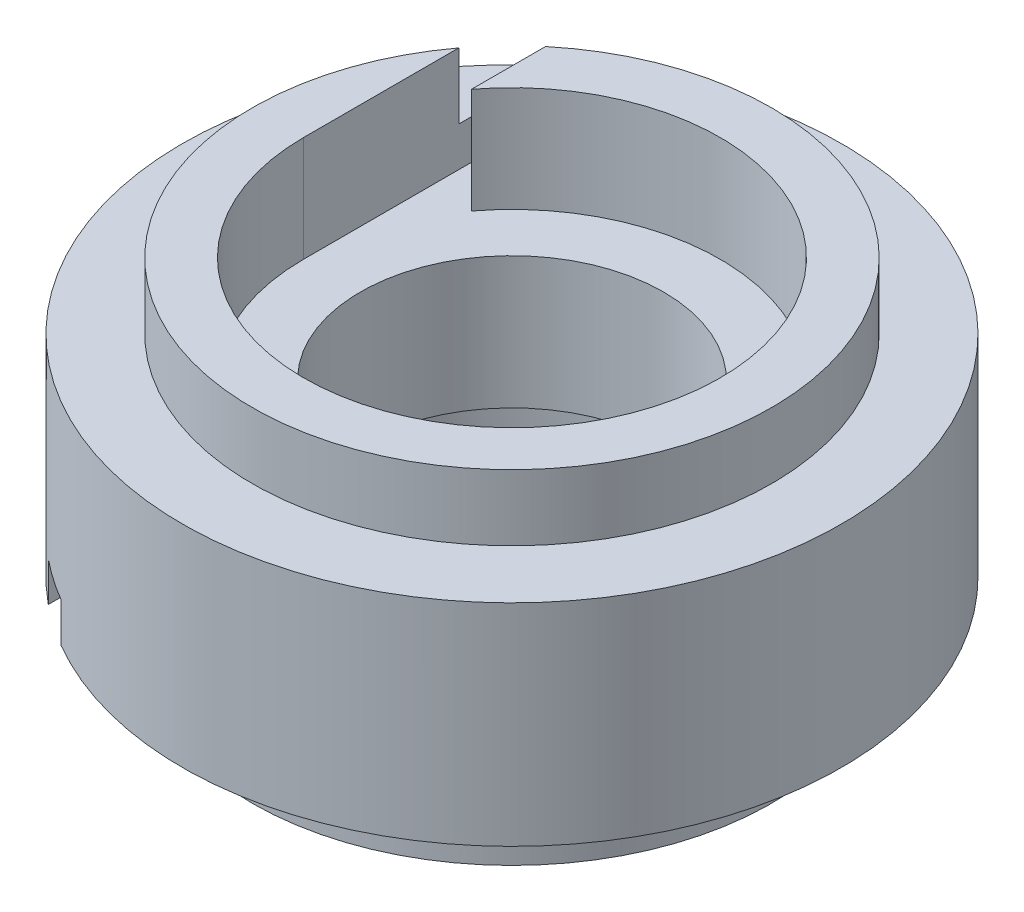
from build123d import *

# Parameters (mm, degrees)
SKETCH1_R           = 31.75
SKETCH1_R_2         = 14.605
BOSS_EXTRUDE1_DEPTH = 16.51
CUT_EXTRUDE1_DEPTH  = 10.16
SKETCH13_R          = 31.75
SKETCH13_R_2        = 25.019
CUT_EXTRUDE2_DEPTH  = 6.35
CIRPATTERN1_COUNT   = 2


with BuildPart() as part:
    # Sketch1 → Boss-Extrude1 (new, symmetric)
    with BuildSketch(Plane(origin=(0, 0, 0), x_dir=(1, 0, 0), z_dir=(0, 1, 0))):
        Circle(SKETCH1_R)
        Circle(SKETCH1_R_2, mode=Mode.SUBTRACT)
    extrude(amount=BOSS_EXTRUDE1_DEPTH, both=True)

    # Sketch2 → Cut-Extrude1 (cut)
    with BuildSketch(Plane(origin=(0, 16.51, 0), x_dir=(1, 0, 0), z_dir=(0, 1, 0))):
        with BuildLine():
            Line((-20.066, 0), (-20.066, 24.60524627))
            ThreePointArc((-20.066, 24.60524627), (-18.088933462, 26.093159759), (-16.002, 27.422590979))
            Line((-16.002, 27.422590979), (-16.002, 12.107037292))
            ThreePointArc((-16.002, 12.107037292), (19.022887373, -6.385460986), (-20.066, 0))
        make_face()
    cut_extrude1 = extrude(amount=-CUT_EXTRUDE1_DEPTH, mode=Mode.SUBTRACT)

    # Sketch13 → Cut-Extrude2 (cut)
    with BuildSketch(Plane(origin=(0, 16.51, 0), x_dir=(1, 0, 0), z_dir=(0, 1, 0))):
        Circle(SKETCH13_R)
        Circle(SKETCH13_R_2, mode=Mode.SUBTRACT)
    cut_extrude2 = extrude(amount=-CUT_EXTRUDE2_DEPTH, mode=Mode.SUBTRACT)

    # CirPattern1: Cut-Extrude1, Cut-Extrude2 ×2 about axis
    cirpattern1_axis = Axis((34.925, 0, 0), (-1, 0, 0))
    add([cut_extrude1.rotate(cirpattern1_axis, i * 360 / CIRPATTERN1_COUNT) for i in range(1, CIRPATTERN1_COUNT)], mode=Mode.SUBTRACT)
    add([cut_extrude2.rotate(cirpattern1_axis, i * 360 / CIRPATTERN1_COUNT) for i in range(1, CIRPATTERN1_COUNT)], mode=Mode.SUBTRACT)


solid = part.part
